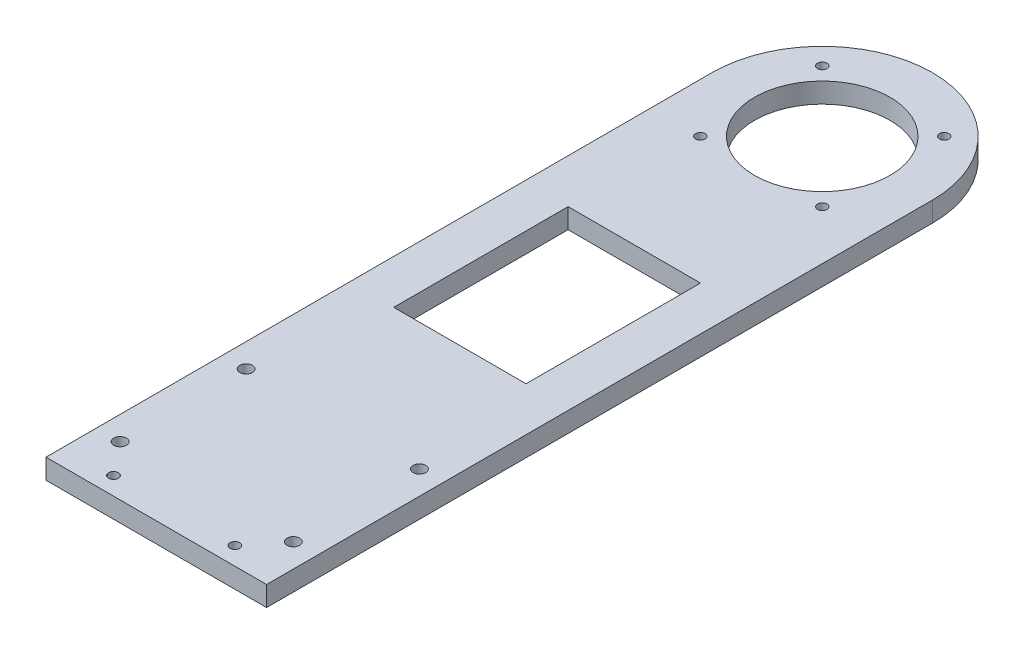
from build123d import *

# Parameters (mm, degrees)
BOSS_EXTRUDE1_DEPTH = 3.175
SKETCH2_R           = 21.5
CUT_EXTRUDE1_DEPTH  = 215.322525648
SKETCH3_W           = 42
SKETCH3_H           = 55.35
CUT_EXTRUDE2_DEPTH  = 215.322525648
SKETCH4_R           = 1.5
CUT_EXTRUDE3_DEPTH  = 215.322525648
SKETCH5_R           = 2
CUT_EXTRUDE4_DEPTH  = 215.322525648
SKETCH7_R           = 1.55
CUT_EXTRUDE6_DEPTH  = 10


with BuildPart() as part:
    # Sketch1 → Boss-Extrude1 (new, symmetric)
    with BuildSketch(Plane(origin=(0, 0, 0), x_dir=(1, 0, 0), z_dir=(0, 1, 0))):
        with BuildLine():
            Line((35, -211.35), (35, 0))
            ThreePointArc((35, 0), (0, 35), (-35, 0))
            Line((-35, 0), (-35, -211.35))
            Line((-35, -211.35), (35, -211.35))
        make_face()
    extrude(amount=BOSS_EXTRUDE1_DEPTH, both=True)

    # Sketch2 → Cut-Extrude1 (cut, through all)
    with BuildSketch(Plane(origin=(0, 3.175, 0), x_dir=(1, 0, 0), z_dir=(0, 1, 0))):
        with Locations(Location((0, 0, 0), (0, 0, 270))):
            Circle(SKETCH2_R)
    extrude(amount=-CUT_EXTRUDE1_DEPTH, mode=Mode.SUBTRACT)

    # Sketch3 → Cut-Extrude2 (cut, through all)
    with BuildSketch(Plane(origin=(0, 3.175, 0), x_dir=(1, 0, 0), z_dir=(0, 1, 0))):
        with Locations((0, -87.325)):
            Rectangle(SKETCH3_W, SKETCH3_H)
    extrude(amount=-CUT_EXTRUDE2_DEPTH, mode=Mode.SUBTRACT)

    # Sketch4 → Cut-Extrude3 (cut, through all)
    with BuildSketch(Plane.XZ.offset(3.175)):
        with Locations(Location((-19.35, 19.35, 0), (0, 0, 270))):
            Circle(SKETCH4_R)
        with Locations(Location((19.35, 19.35, 0), (0, 0, 270))):
            Circle(SKETCH4_R)
        with Locations(Location((19.35, -19.35, 0), (0, 0, 270))):
            Circle(SKETCH4_R)
        with Locations(Location((-19.35, -19.35, 0), (0, 0, 270))):
            Circle(SKETCH4_R)
    extrude(amount=-CUT_EXTRUDE3_DEPTH, mode=Mode.SUBTRACT)

    # Sketch5 → Cut-Extrude4 (cut, through all)
    with BuildSketch(Plane(origin=(0, 3.175, 0), x_dir=(1, 0, 0), z_dir=(0, 1, 0))):
        with Locations((15, -65.35)):
            Circle(SKETCH5_R)
        with Locations((-15, -65.35)):
            Circle(SKETCH5_R)
        with Locations(Location((27.5, -195.35, 0), (0, 0, 270))):
            Circle(SKETCH5_R)
        with Locations(Location((-27.5, -195.35, 0), (0, 0, 270))):
            Circle(SKETCH5_R)
        with Locations(Location((27.5, -155.35, 0), (0, 0, 90))):
            Circle(SKETCH5_R)
        with Locations(Location((-27.5, -155.35, 0), (0, 0, 90))):
            Circle(SKETCH5_R)
    extrude(amount=-CUT_EXTRUDE4_DEPTH, mode=Mode.SUBTRACT)

    # Sketch7 → Cut-Extrude6 (cut)
    with BuildSketch(Plane(origin=(0, 3.175, 0), x_dir=(1, 0, 0), z_dir=(0, 1, 0))):
        with Locations(Location((-19.25, -205.675, 0), (0, 0, 270))):
            Circle(SKETCH7_R)
        with Locations(Location((19.25, -205.675, 0), (0, 0, 270))):
            Circle(SKETCH7_R)
    extrude(amount=-CUT_EXTRUDE6_DEPTH, mode=Mode.SUBTRACT)


solid = part.part
